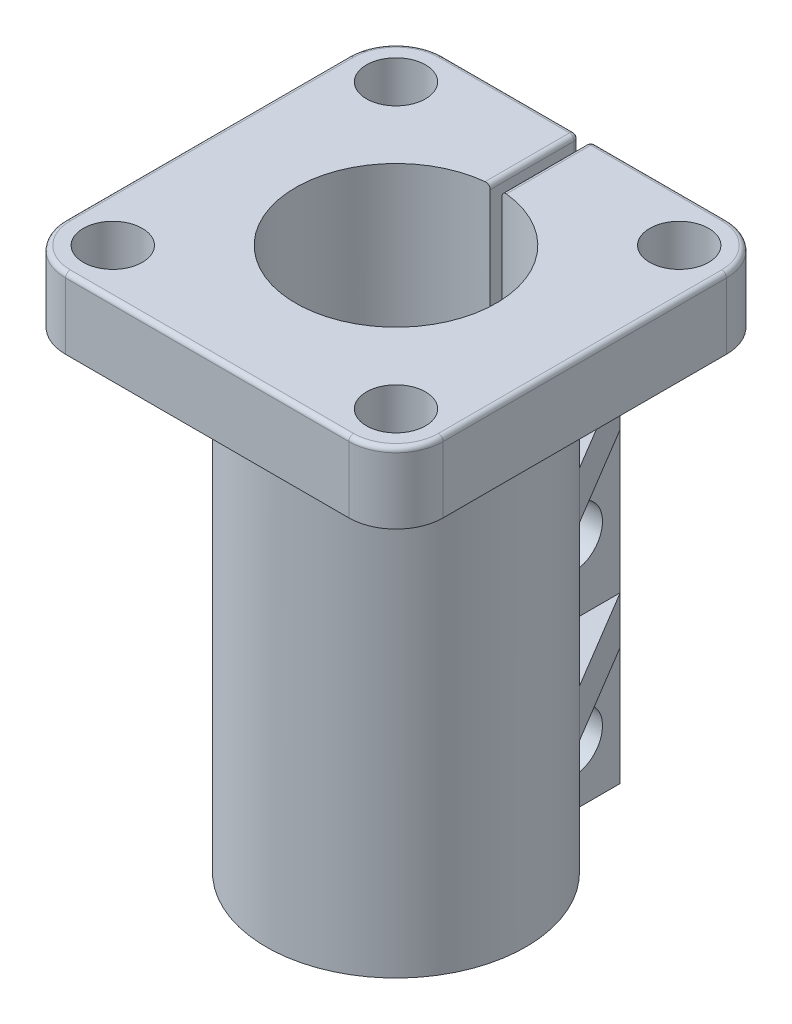
from build123d import *

# Parameters (mm, degrees)
EXTRUDE_1_DEPTH          = 20
SKETCH_2_W               = 16
SKETCH_2_H               = 16
EXTRUDE_2_DEPTH          = 3
CUT_EXTRUDE_1_DEPTH      = 26.632011236
RIB_1_REACH              = 27.632
SKETCH_4_WALL_W          = 56.799556378
SKETCH_4_WALL_H          = 2
PATTERN_CIRCULAR_1_COUNT = 4
EXTRUDE_3_DEPTH          = 2
PATTERN_LINEAR_1_COUNT   = 2
PATTERN_LINEAR_1_PITCH   = 8
MIRROR_1_COPY_1_DEPTH    = 2
FILLET_1_R               = 2
FILLET_2_R               = 0.2
FILLET_4_R               = 0.2
HOLE_WIZARD_M3_1_D       = 2.5
CUT_EXTRUDE_2_DEPTH      = 27.139051364
CUT_EXTRUDE_2_DEPTH_BACK = 27.139051364
SKETCH_11_R              = 1.25
SKETCH_12_R              = 1.75
CUT_EXTRUDE_3_DEPTH      = 2
CUT_EXTRUDE_4_DEPTH      = 2
CUT_EXTRUDE_5_DEPTH      = 8


with BuildPart() as part:
    # 草图1 → 凸台-拉伸1 (new body)
    with BuildSketch(Plane(origin=(0, 0, 0), x_dir=(1, 0, 0), z_dir=(0, 1, 0))):
        with BuildLine():
            Line((-0.25, 8), (-0.25, 4.242640687))
            ThreePointArc((-0.25, 4.242640687), (0, -4.25), (0.25, 4.242640687))
            Line((0.25, 4.242640687), (0.25, 8))
            Line((0.25, 8), (1.5, 8))
            Line((1.5, 8), (1.5, 5.291502622))
            ThreePointArc((1.5, 5.291502622), (0, -5.5), (-1.5, 5.291502622))
            Line((-1.5, 5.291502622), (-1.5, 8))
            Line((-1.5, 8), (-0.25, 8))
        make_face()
    extrude(amount=EXTRUDE_1_DEPTH)

    # 草图2 → 凸台-拉伸2 (add)
    with BuildSketch(Plane(origin=(0, 20, 0), x_dir=(1, 0, 0), z_dir=(0, 1, 0))):
        Rectangle(SKETCH_2_W, SKETCH_2_H)
    extrude(amount=EXTRUDE_2_DEPTH)

    # 草图3 → 切除-拉伸1 (cut, through all)
    with BuildSketch(Plane.XZ):
        with BuildLine():
            Line((-0.25, -8), (0.25, -8))
            Line((0.25, -8), (0.25, -4.242640687))
            ThreePointArc((0.25, -4.242640687), (0, 4.25), (-0.25, -4.242640687))
            Line((-0.25, -4.242640687), (-0.25, -8))
        make_face()
    extrude(amount=-CUT_EXTRUDE_1_DEPTH, mode=Mode.SUBTRACT)

    # 草图4 wall → 筋1 (add, up to next)
    with BuildSketch(Plane(origin=(-6.75, 18.75, 0), x_dir=(0.707106781187, -0.707106781187, 0), z_dir=(0.707106781187, 0.707106781187, 0)), mode=Mode.PRIVATE) as rib_1_sk1:
        Rectangle(SKETCH_4_WALL_W, SKETCH_4_WALL_H)
    rib_1_tool1 = extrude(rib_1_sk1.sketch, amount=RIB_1_REACH, mode=Mode.PRIVATE) - part.part
    rib_1 = rib_1_tool1.solids().sort_by_distance((-6.75, 18.75, 0))[0]
    add(rib_1)

    # 阵列(圆周)1: 筋1 ×4 about axis, 1 skipped
    pattern_circular_1_axis = Axis((0, 0, 0), (0, 1, 0))
    add([rib_1.rotate(pattern_circular_1_axis, i * 360 / PATTERN_CIRCULAR_1_COUNT) for i in range(1, PATTERN_CIRCULAR_1_COUNT) if i not in (3,)])

    # 草图6 → 凸台-拉伸3 (add)
    with BuildSketch(Plane(origin=(0, 5, 0), x_dir=(1, 0, 0), z_dir=(0, 1, 0))):
        with BuildLine():
            Line((-1.5, 8), (-4.066385849, 3.703310158))
            ThreePointArc((-4.066385849, 3.703310158), (-2.894261854, 4.676884467), (-1.5, 5.291502622))
            Line((-1.5, 5.291502622), (-1.5, 8))
        make_face()
    extrude_3 = extrude(amount=EXTRUDE_3_DEPTH)

    # 阵列(线性)1: 凸台-拉伸3 ×2
    with Locations(*[(0, i * PATTERN_LINEAR_1_PITCH, 0) for i in range(1, PATTERN_LINEAR_1_COUNT)]):
        add(extrude_3)

    # 镜向1: 凸台-拉伸3 across plane
    add(extrude_3.mirror(Plane(origin=(0, 0, 0), x_dir=(0, 0, 1), z_dir=(1, 0, 0))))

    # 镜向1 copy 1 sketch → 镜向1 copy 1 (add)
    with BuildSketch(Plane(origin=(0, 13, 0), x_dir=(-1, 0, 0), z_dir=(0, 1, 0))):
        with BuildLine():
            Line((-1.5, -8), (-4.066385849, -3.703310158))
            ThreePointArc((-4.066385849, -3.703310158), (-2.894261854, -4.676884467), (-1.5, -5.291502622))
            Line((-1.5, -5.291502622), (-1.5, -8))
        make_face()
    extrude(amount=MIRROR_1_COPY_1_DEPTH)

    # 圆角1
    fillet_1_edges = [part.edges().sort_by_distance(p)[0] for p in [
        (-8, 21.5, -8),
        (-8, 21.5, 8),
        (8, 21.5, 8),
        (8, 21.5, -8),
    ]]
    fillet(fillet_1_edges, radius=FILLET_1_R)

    # 圆角2
    fillet_2_edges = [part.edges().sort_by_distance(p)[0] for p in [
        (-0.25, 10, -8),
        (0.25, 10, -8),
    ]]
    fillet(fillet_2_edges, radius=FILLET_2_R)

    # 圆角4
    fillet_4_edges = [part.edges().sort_by_distance(p)[0] for p in [
        (3.225, 23, -8),
        (8, 23, 0),
        (-8, 23, 0),
        (0, 23, 8),
        (-7.414213562, 23, -7.414213562),
        (-7.414213562, 23, 7.414213562),
        (7.414213562, 23, 7.414213562),
        (7.414213562, 23, -7.414213562),
        (0.25, 23, -6.021320344),
        (-3.225, 23, -8),
        (-0.308578644, 23, -7.941421356),
        (0.308578644, 23, -7.941421356),
        (-0.25, 23, -6.021320344),
    ]]
    fillet(fillet_4_edges, radius=FILLET_4_R)

    # M3 螺纹孔的螺纹孔钻头1 (through all)
    with Locations(Plane(origin=(0, 20, 0), x_dir=(-1, 0, 0), z_dir=(0, -1, 0))):
        with Locations((6, 6), (6, -6), (-6, 6), (-6, -6)):
            Hole(HOLE_WIZARD_M3_1_D / 2)

    # 草图11 → 切除-拉伸2 (cut, two sides: drawn at the far end of the back side and taken through both)
    with BuildSketch(Plane.ZY.offset(1.5).offset(-CUT_EXTRUDE_2_DEPTH_BACK)):
        with Locations(Location((-6, 17.5, 0), (0, 0, 304.527234227))):
            Circle(SKETCH_11_R)
        with Locations(Location((-6, 10, 0), (0, 0, 304.527234227))):
            Circle(SKETCH_11_R)
        with Locations(Location((-6, 2.5, 0), (0, 0, 304.527234227))):
            Circle(SKETCH_11_R)
    extrude(amount=CUT_EXTRUDE_2_DEPTH + CUT_EXTRUDE_2_DEPTH_BACK, mode=Mode.SUBTRACT)

    # 草图12 → 切除-拉伸3 (cut)
    with BuildSketch(Plane.ZY.offset(1.5)):
        with Locations((-6, 17.5)):
            Circle(SKETCH_12_R)
        with Locations((-6, 10)):
            Circle(SKETCH_12_R)
        with Locations((-6, 2.5)):
            Circle(SKETCH_12_R)
    extrude(amount=CUT_EXTRUDE_3_DEPTH, mode=Mode.SUBTRACT)

    # 草图13 → 切除-拉伸4 (cut)
    with BuildSketch(Plane(origin=(1.5, 0, 0), x_dir=(0, 0, -1), z_dir=(1, 0, 0))):
        Polygon((6, 19.520725942), (4.25, 18.510362971), (4.25, 16.489637029), (6, 15.479274058), (7.75, 16.489637029), (7.75, 18.510362971), align=None)
        Polygon((6, 12.020725942), (4.25, 11.010362971), (4.25, 8.989637029), (6, 7.979274058), (7.75, 8.989637029), (7.75, 11.010362971), align=None)
        Polygon((6, 4.520725942), (4.25, 3.510362971), (4.25, 1.489637029), (6, 0.479274058), (7.75, 1.489637029), (7.75, 3.510362971), align=None)
    extrude(amount=CUT_EXTRUDE_4_DEPTH, mode=Mode.SUBTRACT)

    # 草图16 → 切除-拉伸5 (cut)
    with BuildSketch(Plane.XY.offset(8)):
        with BuildLine():
            Line((-3.8, 19), (-1.7, 19))
            ThreePointArc((-1.7, 19), (-1.558578644, 18.941421356), (-1.5, 18.8))
            Line((-1.5, 18.8), (-1.5, 17.7))
            ThreePointArc((-1.5, 17.7), (-1.558578644, 17.558578644), (-1.7, 17.5))
            Line((-1.7, 17.5), (-3.8, 17.5))
            ThreePointArc((-3.8, 17.5), (-3.941421356, 17.558578644), (-4, 17.7))
            Line((-4, 17.7), (-4, 18.8))
            ThreePointArc((-4, 18.8), (-3.941421356, 18.941421356), (-3.8, 19))
        make_face()
        with BuildLine():
            Line((1.5, 18.8), (1.5, 17.7))
            ThreePointArc((1.5, 17.7), (1.558578644, 17.558578644), (1.7, 17.5))
            Line((1.7, 17.5), (3.8, 17.5))
            ThreePointArc((3.8, 17.5), (3.941421356, 17.558578644), (4, 17.7))
            Line((4, 17.7), (4, 18.8))
            ThreePointArc((4, 18.8), (3.941421356, 18.941421356), (3.8, 19))
            Line((3.8, 19), (1.7, 19))
            ThreePointArc((1.7, 19), (1.558578644, 18.941421356), (1.5, 18.8))
        make_face()
    extrude(amount=-CUT_EXTRUDE_5_DEPTH, mode=Mode.SUBTRACT)


solid = part.part
